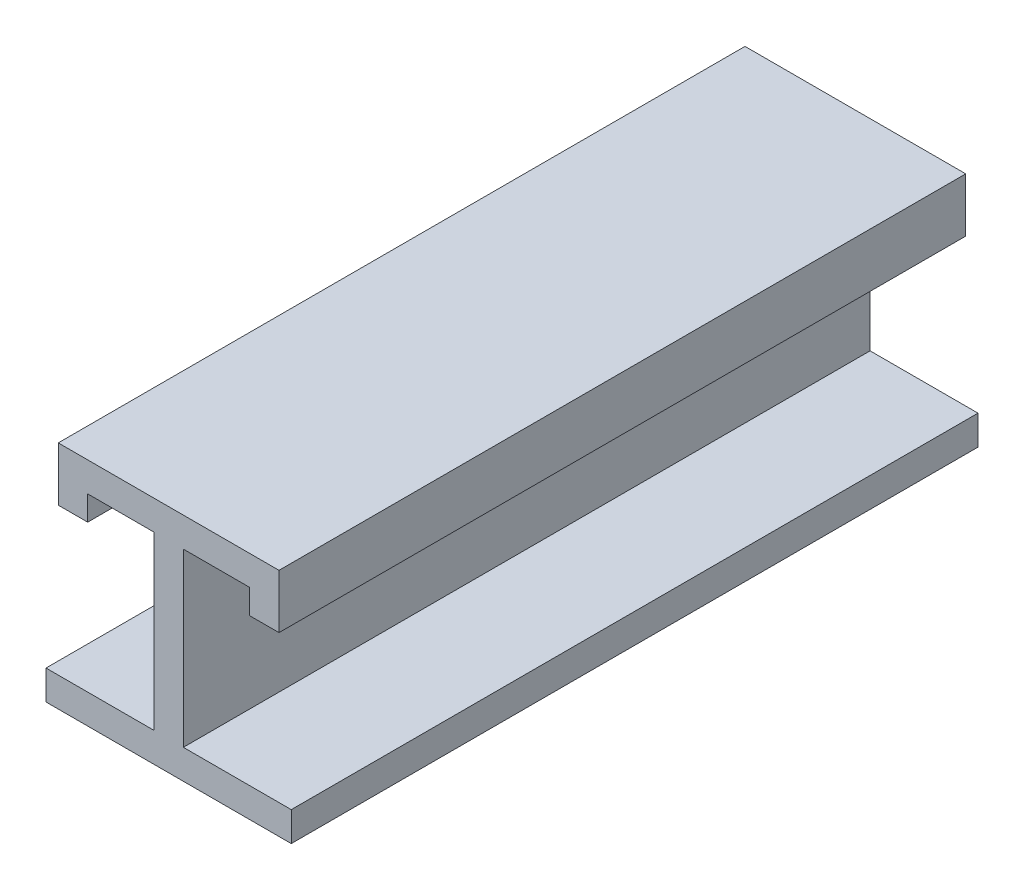
from build123d import *

# Parameters (mm, degrees)
SKETCH_1_W      = 12
SKETCH_1_H      = 70
SKETCH_1_H_2    = 10
EXTRUDE_1_DEPTH = 140


with BuildPart() as part:
    # Эскиз1 → Бобышка-Вытянуть1 (new, symmetric)
    with BuildSketch(Plane.XY):
        Polygon((-33, 35), (-6, 35), (6, 35), (33, 35), (45, 35), (45, 47), (-45, 47), (-45, 35), align=None)
        Rectangle(SKETCH_1_W, SKETCH_1_H)
        Polygon((6, -35), (-6, -35), (-50, -35), (-50, -47), (50, -47), (50, -35), align=None)
        with Locations((39, 30)):
            Rectangle(SKETCH_1_W, SKETCH_1_H_2)
        with Locations((-39, 30)):
            Rectangle(SKETCH_1_W, SKETCH_1_H_2)
    extrude(amount=EXTRUDE_1_DEPTH, both=True)


solid = part.part
